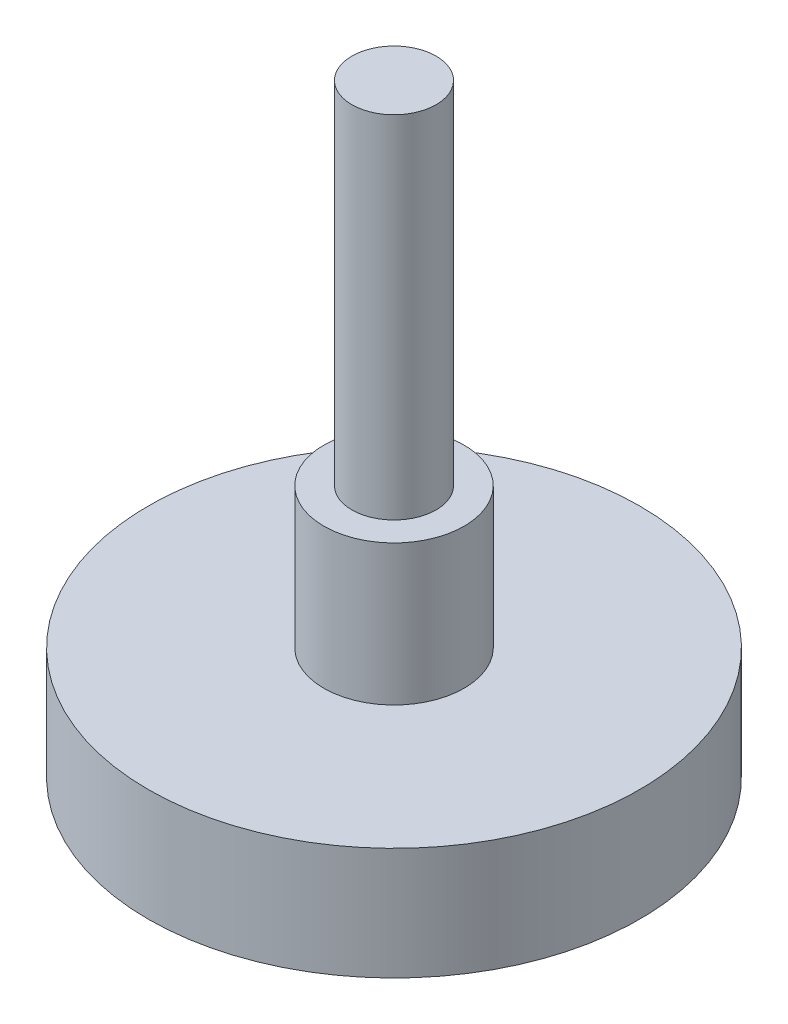
from build123d import *

# Parameters (mm, degrees)
SKETCH2_R           = 17.5
BOSS_EXTRUDE1_DEPTH = 8
SKETCH3_R           = 5
BOSS_EXTRUDE2_DEPTH = 10
SKETCH4_R           = 3
BOSS_EXTRUDE3_DEPTH = 25


with BuildPart() as part:
    # Sketch2 → Boss-Extrude1 (new body)
    with BuildSketch(Plane(origin=(0, 0, 0), x_dir=(1, 0, 0), z_dir=(0, 1, 0))):
        with Locations(Location((0, 0, 0), (0, 0, 270))):
            Circle(SKETCH2_R)
    extrude(amount=BOSS_EXTRUDE1_DEPTH)

    # Sketch3 → Boss-Extrude2 (add)
    with BuildSketch(Plane(origin=(0, 8, 0), x_dir=(1, 0, 0), z_dir=(0, 1, 0))):
        with Locations(Location((0, 0, 0), (0, 0, 270))):
            Circle(SKETCH3_R)
    extrude(amount=BOSS_EXTRUDE2_DEPTH)

    # Sketch4 → Boss-Extrude3 (add)
    with BuildSketch(Plane(origin=(0, 18, 0), x_dir=(1, 0, 0), z_dir=(0, 1, 0))):
        with Locations(Location((0, 0, 0), (0, 0, 270))):
            Circle(SKETCH4_R)
    extrude(amount=BOSS_EXTRUDE3_DEPTH)


solid = part.part
